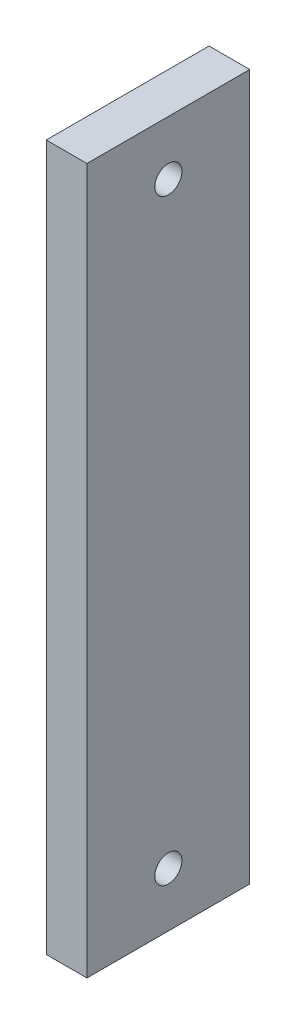
from build123d import *

# Parameters (mm, degrees)
SKETCH1_W           = 9.525
SKETCH1_H           = 38.1
BOSS_EXTRUDE1_DEPTH = 165.1
SKETCH2_R           = 3.175
CUT_EXTRUDE1_DEPTH  = 101.6


with BuildPart() as part:
    # Sketch1 → Boss-Extrude1 (new body)
    with BuildSketch(Plane(origin=(0, 0, 0), x_dir=(1, 0, 0), z_dir=(0, 1, 0))):
        Rectangle(SKETCH1_W, SKETCH1_H)
    extrude(amount=BOSS_EXTRUDE1_DEPTH)

    # Sketch2 → Cut-Extrude1 (cut)
    with BuildSketch(Plane(origin=(4.7625, 0, 0), x_dir=(0, 0, -1), z_dir=(1, 0, 0))):
        with Locations((0, 152.4)):
            Circle(SKETCH2_R)
        with Locations((0, 12.7)):
            Circle(SKETCH2_R)
    extrude(amount=-CUT_EXTRUDE1_DEPTH, mode=Mode.SUBTRACT)


solid = part.part
